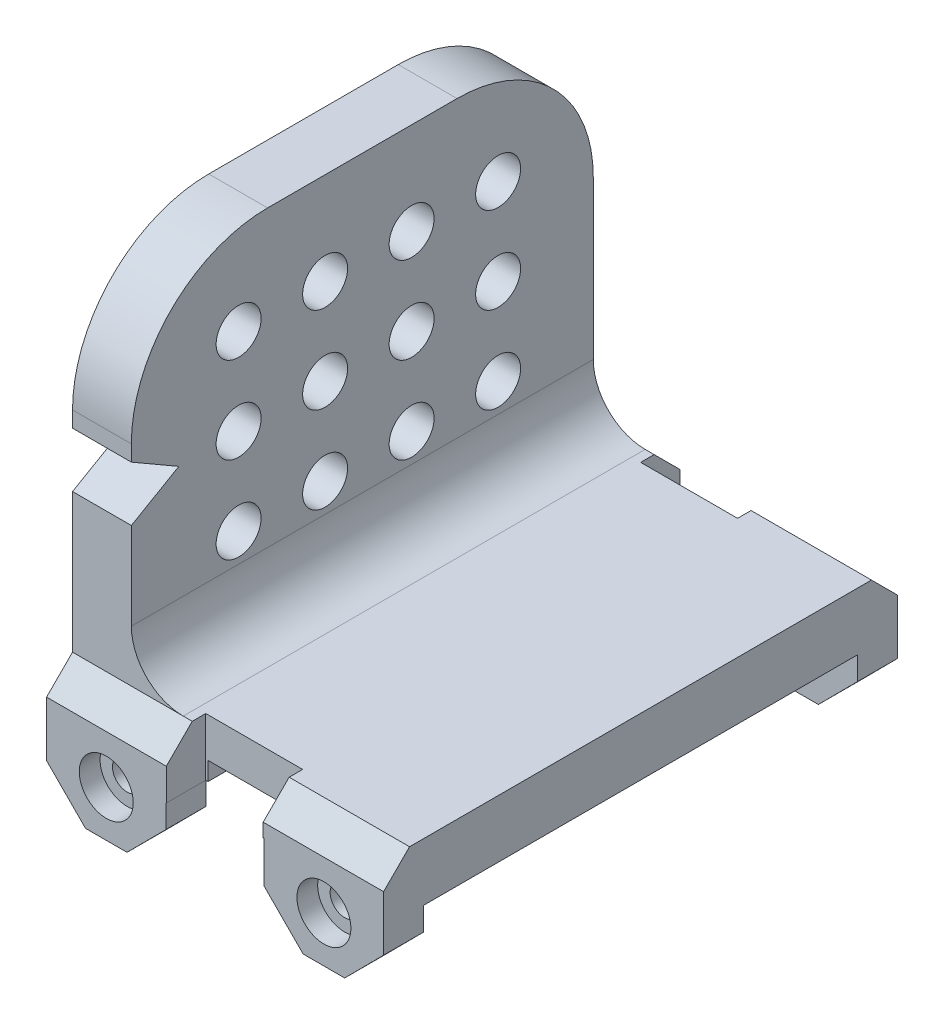
from build123d import *

# Parameters (mm, degrees)
SKETCH1_W                                  = 24.7396
SKETCH1_H                                  = 37.719
BOSS_EXTRUDE1_DEPTH                        = 4.2418
BOSS_EXTRUDE2_DEPTH                        = 2.9464
MIRROR2_COPY_1_DEPTH                       = 2.9464
SKETCH3_W                                  = 6.985
SKETCH3_H                                  = 31.8262
CUT_EXTRUDE1_DEPTH                         = 1.3462
LPATTERN1_COUNT                            = 3
LPATTERN1_PITCH                            = 7.9502
SKETCH4_R                                  = 1.0668
CUT_EXTRUDE2_DEPTH                         = 40.958840453
SKETCH5_R                                  = 1.9812
CUT_EXTRUDE3_DEPTH                         = 1.524
MIRROR4_AT_THE_SECOND_PLANE_COPY_1_SKETC_R = 1.9812
MIRROR4_AT_THE_SECOND_PLANE_COPY_1_DEPTH   = 1.524
SKETCH6_W                                  = 7.112
SKETCH6_H                                  = 2.8956
CUT_EXTRUDE4_DEPTH                         = 25.218015153
SKETCH7_W                                  = 6.987300404
SKETCH7_H                                  = 1.344727602
CUT_EXTRUDE5_DEPTH                         = 63.5
CHAMFER2_SIZE                              = 1.905
SKETCH8_W                                  = 4.318
SKETCH8_H                                  = 33.909
BOSS_EXTRUDE3_DEPTH                        = 25.4
SKETCH9_R                                  = 1.651
CUT_EXTRUDE6_DEPTH                         = 25.4
FILLET1_R                                  = 10
FILLET2_R                                  = 3.81
LPATTERN4_COUNT                            = 2
LPATTERN4_PITCH                            = 6.35
LPATTERN4_COUNT_DIR2                       = 4
LPATTERN4_PITCH_DIR2                       = 6.35
LPATTERN5_COUNT                            = 2
LPATTERN5_PITCH                            = 6.35
LPATTERN5_COPY_1_SKETCH_R                  = 1.651
LPATTERN5_COPY_1_DEPTH                     = 25.4
LPATTERN5_COPY_2_SKETCH_R                  = 1.651
LPATTERN5_COPY_2_DEPTH                     = 25.4
LPATTERN5_COPY_3_SKETCH_R                  = 1.651
LPATTERN5_COPY_3_DEPTH                     = 25.4
LPATTERN5_COPY_4_SKETCH_R                  = 1.651
LPATTERN5_COPY_4_DEPTH                     = 25.4
LPATTERN5_COPY_5_SKETCH_R                  = 1.651
LPATTERN5_COPY_5_DEPTH                     = 25.4
LPATTERN5_COPY_6_SKETCH_R                  = 1.651
LPATTERN5_COPY_6_DEPTH                     = 25.4
LPATTERN5_COPY_7_SKETCH_R                  = 1.651
LPATTERN5_COPY_7_DEPTH                     = 25.4
CUT_EXTRUDE7_DEPTH                         = 25.4


with BuildPart() as part:
    # Sketch1 → Boss-Extrude1 (new body)
    with BuildSketch(Plane(origin=(0, 0, 0), x_dir=(1, 0, 0), z_dir=(0, 1, 0))):
        Rectangle(SKETCH1_W, SKETCH1_H)
    extrude(amount=BOSS_EXTRUDE1_DEPTH)

    # Sketch2 → Boss-Extrude2 (add)
    with BuildSketch(Plane(origin=(0, 0, -18.8595), x_dir=(-1, 0, 0), z_dir=(0, 0, -1))):
        Polygon((-12.3698, -1.7018), (-12.3698, 4.2418), (-3.6068, 4.2418), (-3.6068, -1.7018), (-6.4643, -4.579739869), (-9.5123, -4.579739869), align=None)
    boss_extrude2 = extrude(amount=-BOSS_EXTRUDE2_DEPTH)

    # Mirror1: Boss-Extrude2 across plane
    add(boss_extrude2.mirror(Plane(origin=(0, 0, 0), x_dir=(0, 0, 1), z_dir=(1, 0, 0))))

    # Mirror2: Boss-Extrude2 across plane
    add(boss_extrude2.mirror(Plane.XY))

    # Mirror2 copy 1 sketch → Mirror2 copy 1 (add)
    with BuildSketch(Plane.XY.offset(18.8595)):
        Polygon((-12.3698, -1.7018), (-12.3698, 4.2418), (-3.6068, 4.2418), (-3.6068, -1.7018), (-6.4643, -4.579739869), (-9.5123, -4.579739869), align=None)
    extrude(amount=-MIRROR2_COPY_1_DEPTH)

    # Sketch3 → Cut-Extrude1 (cut)
    with BuildSketch(Plane.XZ):
        with Locations((-7.8613, 0)):
            Rectangle(SKETCH3_W, SKETCH3_H)
    cut_extrude1 = extrude(amount=-CUT_EXTRUDE1_DEPTH, mode=Mode.SUBTRACT)

    # LPattern1: Cut-Extrude1 ×3
    with Locations(*[(i * LPATTERN1_PITCH, 0, 0) for i in range(1, LPATTERN1_COUNT)]):
        add(cut_extrude1, mode=Mode.SUBTRACT)

    # Sketch4 → Cut-Extrude2 (cut, symmetric)
    with BuildSketch(Plane(origin=(0, 0, -18.8595), x_dir=(-1, 0, 0), z_dir=(0, 0, -1))):
        with Locations((-7.9883, -1.201539869)):
            Circle(SKETCH4_R)
    cut_extrude2 = extrude(amount=CUT_EXTRUDE2_DEPTH, both=True, mode=Mode.SUBTRACT)

    # Mirror3: Cut-Extrude2 across plane
    add(cut_extrude2.mirror(Plane(origin=(0, 0, 0), x_dir=(0, 0, 1), z_dir=(1, 0, 0))), mode=Mode.SUBTRACT)

    # Sketch5 → Cut-Extrude3 (cut)
    with BuildSketch(Plane(origin=(0, 0, -18.8595), x_dir=(-1, 0, 0), z_dir=(0, 0, -1))):
        with Locations((-7.9883, -1.201539869)):
            Circle(SKETCH5_R)
    cut_extrude3 = extrude(amount=-CUT_EXTRUDE3_DEPTH, mode=Mode.SUBTRACT)

    # Mirror4: Cut-Extrude3 across plane
    add(cut_extrude3.mirror(Plane.XY), mode=Mode.SUBTRACT)

    # Mirror4 at the second plane: Cut-Extrude3 across plane
    add(cut_extrude3.mirror(Plane(origin=(0, 0, 0), x_dir=(0, 0, 1), z_dir=(1, 0, 0))), mode=Mode.SUBTRACT)

    # Mirror4 at the second plane copy 1 sketc → Mirror4 at the second plane copy 1 (cut)
    with BuildSketch(Plane.XY.offset(18.8595)):
        with Locations((-7.9883, -1.201539869)):
            Circle(MIRROR4_AT_THE_SECOND_PLANE_COPY_1_SKETC_R)
    extrude(amount=-MIRROR4_AT_THE_SECOND_PLANE_COPY_1_DEPTH, mode=Mode.SUBTRACT)

    # Sketch6 → Cut-Extrude4 (cut, through all)
    with BuildSketch(Plane(origin=(0, 4.2418, 0), x_dir=(1, 0, 0), z_dir=(0, 1, 0))):
        with Locations((-0.0254, 17.4117)):
            Rectangle(SKETCH6_W, SKETCH6_H)
    cut_extrude4 = extrude(amount=-CUT_EXTRUDE4_DEPTH, mode=Mode.SUBTRACT)

    # Mirror5: Cut-Extrude4 across plane
    add(cut_extrude4.mirror(Plane.XY), mode=Mode.SUBTRACT)

    # Sketch7 → Cut-Extrude5 (cut, symmetric)
    with BuildSketch(Plane(origin=(0, 0, 15.9131), x_dir=(-1, 0, 0), z_dir=(0, 0, -1))):
        with Locations((-0.083466761, 0.672363801)):
            Rectangle(SKETCH7_W, SKETCH7_H)
    extrude(amount=CUT_EXTRUDE5_DEPTH, both=True, mode=Mode.SUBTRACT)

    # Chamfer2
    chamfer2_edges = [part.edges().sort_by_distance(p)[0] for p in [
        (7.9502, 4.2418, -18.8595),
        (-7.9756, 4.2418, -18.8595),
        (7.9502, 4.2418, 18.8595),
        (-7.9756, 4.2418, 18.8595),
    ]]
    chamfer(chamfer2_edges, length=CHAMFER2_SIZE)

    # Sketch8 → Boss-Extrude3 (add)
    with BuildSketch(Plane(origin=(0, 4.2418, 0), x_dir=(1, 0, 0), z_dir=(0, 1, 0))):
        with Locations((-10.2108, 0)):
            Rectangle(SKETCH8_W, SKETCH8_H)
    extrude(amount=BOSS_EXTRUDE3_DEPTH)

    # Sketch9 → Cut-Extrude6 (cut)
    with BuildSketch(Plane(origin=(-8.0518, 0, 0), x_dir=(0, 0, -1), z_dir=(1, 0, 0))):
        with Locations((9.9695, 16.51)):
            Circle(SKETCH9_R)
    cut_extrude6 = extrude(amount=-CUT_EXTRUDE6_DEPTH, mode=Mode.SUBTRACT)

    # Fillet1
    fillet1_edges = [part.edges().sort_by_distance(p)[0] for p in [
        (-10.2108, 29.6418, 16.9545),
        (-10.2108, 29.6418, -16.9545),
    ]]
    fillet(fillet1_edges, radius=FILLET1_R)

    # Fillet2
    fillet2_edges = [part.edges().sort_by_distance(p)[0] for p in [
        (-8.0518, 4.2418, 0),
    ]]
    fillet(fillet2_edges, radius=FILLET2_R)

    # LPattern4: Cut-Extrude6 2 × 4
    with Locations(*[(0, -i * LPATTERN4_PITCH, j * LPATTERN4_PITCH_DIR2) for i in range(LPATTERN4_COUNT) for j in range(LPATTERN4_COUNT_DIR2) if (i, j) != (0, 0)]):
        add(cut_extrude6, mode=Mode.SUBTRACT)

    # LPattern5: Cut-Extrude6 ×2
    with Locations(*[(0, i * LPATTERN5_PITCH, 0) for i in range(1, LPATTERN5_COUNT)]):
        add(cut_extrude6, mode=Mode.SUBTRACT)

    # LPattern5 copy 1 sketch → LPattern5 copy 1 (cut)
    with BuildSketch(Plane(origin=(-8.0518, 6.35, 6.35), x_dir=(0, 0, -1), z_dir=(1, 0, 0))):
        with Locations((9.9695, 16.51)):
            Circle(LPATTERN5_COPY_1_SKETCH_R)
    extrude(amount=-LPATTERN5_COPY_1_DEPTH, mode=Mode.SUBTRACT)

    # LPattern5 copy 2 sketch → LPattern5 copy 2 (cut)
    with BuildSketch(Plane(origin=(-8.0518, 6.35, 12.7), x_dir=(0, 0, -1), z_dir=(1, 0, 0))):
        with Locations((9.9695, 16.51)):
            Circle(LPATTERN5_COPY_2_SKETCH_R)
    extrude(amount=-LPATTERN5_COPY_2_DEPTH, mode=Mode.SUBTRACT)

    # LPattern5 copy 3 sketch → LPattern5 copy 3 (cut)
    with BuildSketch(Plane(origin=(-8.0518, 6.35, 19.05), x_dir=(0, 0, -1), z_dir=(1, 0, 0))):
        with Locations((9.9695, 16.51)):
            Circle(LPATTERN5_COPY_3_SKETCH_R)
    extrude(amount=-LPATTERN5_COPY_3_DEPTH, mode=Mode.SUBTRACT)

    # LPattern5 copy 4 sketch → LPattern5 copy 4 (cut)
    with BuildSketch(Plane(origin=(-8.0518, 0, 0), x_dir=(0, 0, -1), z_dir=(1, 0, 0))):
        with Locations((9.9695, 16.51)):
            Circle(LPATTERN5_COPY_4_SKETCH_R)
    extrude(amount=-LPATTERN5_COPY_4_DEPTH, mode=Mode.SUBTRACT)

    # LPattern5 copy 5 sketch → LPattern5 copy 5 (cut)
    with BuildSketch(Plane(origin=(-8.0518, 0, 6.35), x_dir=(0, 0, -1), z_dir=(1, 0, 0))):
        with Locations((9.9695, 16.51)):
            Circle(LPATTERN5_COPY_5_SKETCH_R)
    extrude(amount=-LPATTERN5_COPY_5_DEPTH, mode=Mode.SUBTRACT)

    # LPattern5 copy 6 sketch → LPattern5 copy 6 (cut)
    with BuildSketch(Plane(origin=(-8.0518, 0, 12.7), x_dir=(0, 0, -1), z_dir=(1, 0, 0))):
        with Locations((9.9695, 16.51)):
            Circle(LPATTERN5_COPY_6_SKETCH_R)
    extrude(amount=-LPATTERN5_COPY_6_DEPTH, mode=Mode.SUBTRACT)

    # LPattern5 copy 7 sketch → LPattern5 copy 7 (cut)
    with BuildSketch(Plane(origin=(-8.0518, 0, 19.05), x_dir=(0, 0, -1), z_dir=(1, 0, 0))):
        with Locations((9.9695, 16.51)):
            Circle(LPATTERN5_COPY_7_SKETCH_R)
    extrude(amount=-LPATTERN5_COPY_7_DEPTH, mode=Mode.SUBTRACT)

    # Sketch10 → Cut-Extrude7 (cut)
    with BuildSketch(Plane.ZY.offset(12.3698)):
        Polygon((16.9545, 18.479805683), (13.467820237, 16.466770183), (16.9545, 14.453734683), align=None)
    extrude(amount=-CUT_EXTRUDE7_DEPTH, mode=Mode.SUBTRACT)


solid = part.part
